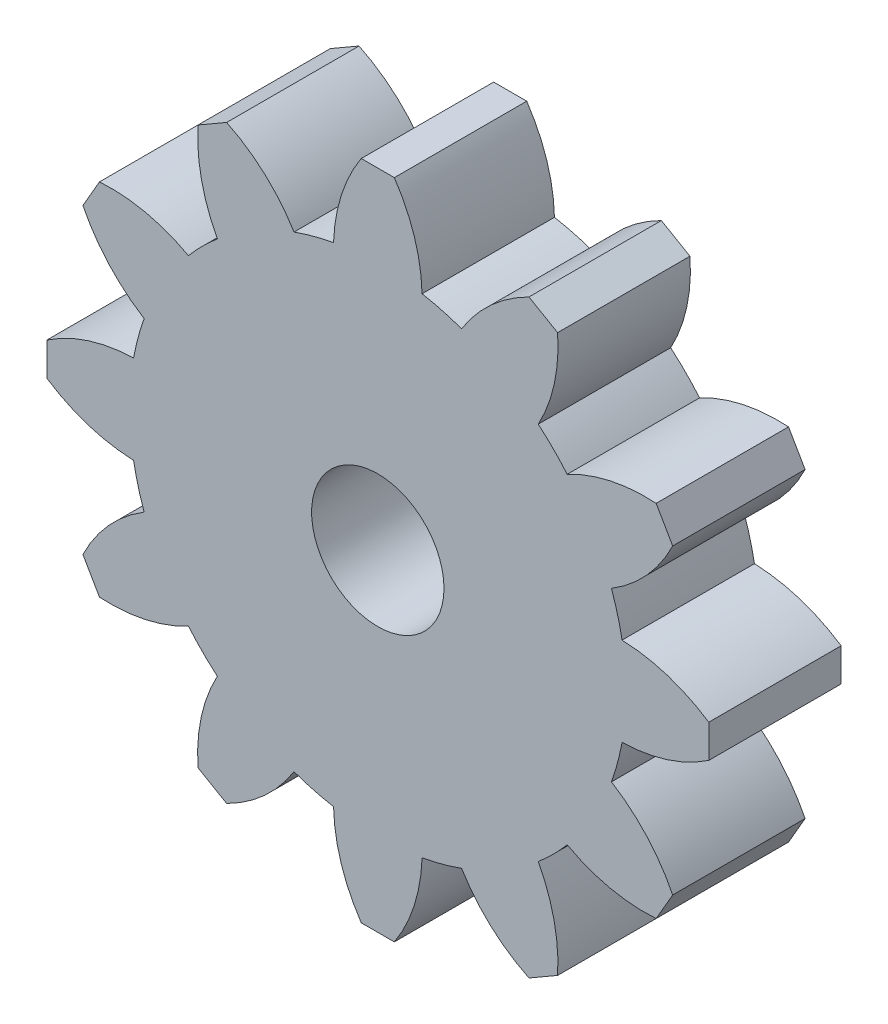
from build123d import *

# Parameters (mm, degrees)
SKETCH1_R           = 4
BOSS_EXTRUDE1_DEPTH = 8


with BuildPart() as part:
    # Sketch1 → Boss-Extrude1 (new body)
    with BuildSketch(Plane(origin=(0, 0, 0), x_dir=(0, 1, 0), z_dir=(0, 0, 1))):
        with BuildLine():
            ThreePointArc((16.820508076, 10.866025404), (14.05137554, 10.65443031), (11.444646973, 9.696393951))
            ThreePointArc((11.444646973, 9.696393951), (10.606601718, 10.606601718), (9.696393951, 11.444646973))
            ThreePointArc((9.696393951, 11.444646973), (10.668335485, 14.048350177), (10.866025404, 16.820508076))
            Line((10.866025404, 16.820508076), (9.133974596, 17.820508076))
            ThreePointArc((9.133974596, 17.820508076), (6.841633021, 16.252695081), (5.063158041, 14.119646973))
            ThreePointArc((5.063158041, 14.119646973), (3.882285677, 14.488887394), (2.675, 14.759551992))
            ThreePointArc((2.675, 14.759551992), (2.214874458, 17.500395877), (1, 20))
            Line((1, 20), (-1, 20))
            ThreePointArc((-1, 20), (-2.201319541, 17.496063331), (-2.675, 14.759551992))
            ThreePointArc((-2.675, 14.759551992), (-3.882285677, 14.488887394), (-5.063158041, 14.119646973))
            ThreePointArc((-5.063158041, 14.119646973), (-6.832060392, 16.263224635), (-9.133974596, 17.820508076))
            Line((-9.133974596, 17.820508076), (-10.866025404, 16.820508076))
            ThreePointArc((-10.866025404, 16.820508076), (-10.65443031, 14.05137554), (-9.696393951, 11.444646973))
            ThreePointArc((-9.696393951, 11.444646973), (-10.606601718, 10.606601718), (-11.444646973, 9.696393951))
            ThreePointArc((-11.444646973, 9.696393951), (-14.048350177, 10.668335485), (-16.820508076, 10.866025404))
            Line((-16.820508076, 10.866025404), (-17.820508076, 9.133974596))
            ThreePointArc((-17.820508076, 9.133974596), (-16.252695081, 6.841633021), (-14.119646973, 5.063158041))
            ThreePointArc((-14.119646973, 5.063158041), (-14.488887394, 3.882285677), (-14.759551992, 2.675))
            ThreePointArc((-14.759551992, 2.675), (-17.500395877, 2.214874458), (-20, 1))
            Line((-20, 1), (-20, -1))
            ThreePointArc((-20, -1), (-17.496063331, -2.201319541), (-14.759551992, -2.675))
            ThreePointArc((-14.759551992, -2.675), (-14.488887394, -3.882285677), (-14.119646973, -5.063158041))
            ThreePointArc((-14.119646973, -5.063158041), (-16.263224635, -6.832060392), (-17.820508076, -9.133974596))
            Line((-17.820508076, -9.133974596), (-16.820508076, -10.866025404))
            ThreePointArc((-16.820508076, -10.866025404), (-14.05137554, -10.65443031), (-11.444646973, -9.696393951))
            ThreePointArc((-11.444646973, -9.696393951), (-10.606601718, -10.606601718), (-9.696393951, -11.444646973))
            ThreePointArc((-9.696393951, -11.444646973), (-10.668335485, -14.048350177), (-10.866025404, -16.820508076))
            Line((-10.866025404, -16.820508076), (-9.133974596, -17.820508076))
            ThreePointArc((-9.133974596, -17.820508076), (-6.841633021, -16.252695081), (-5.063158041, -14.119646973))
            ThreePointArc((-5.063158041, -14.119646973), (-3.882285677, -14.488887394), (-2.675, -14.759551992))
            ThreePointArc((-2.675, -14.759551992), (-2.214874458, -17.500395877), (-1, -20))
            Line((-1, -20), (1, -20))
            ThreePointArc((1, -20), (2.201319541, -17.496063331), (2.675, -14.759551992))
            ThreePointArc((2.675, -14.759551992), (3.882285677, -14.488887394), (5.063158041, -14.119646973))
            ThreePointArc((5.063158041, -14.119646973), (6.832060392, -16.263224635), (9.133974596, -17.820508076))
            Line((9.133974596, -17.820508076), (10.866025404, -16.820508076))
            ThreePointArc((10.866025404, -16.820508076), (10.65443031, -14.05137554), (9.696393951, -11.444646973))
            ThreePointArc((9.696393951, -11.444646973), (10.606601718, -10.606601718), (11.444646973, -9.696393951))
            ThreePointArc((11.444646973, -9.696393951), (14.048350177, -10.668335485), (16.820508076, -10.866025404))
            Line((16.820508076, -10.866025404), (17.820508076, -9.133974596))
            ThreePointArc((17.820508076, -9.133974596), (16.252695081, -6.841633021), (14.119646973, -5.063158041))
            ThreePointArc((14.119646973, -5.063158041), (14.488887394, -3.882285677), (14.759551992, -2.675))
            ThreePointArc((14.759551992, -2.675), (17.500395877, -2.214874458), (20, -1))
            Line((20, -1), (20, 1))
            ThreePointArc((20, 1), (17.496063331, 2.201319541), (14.759551992, 2.675))
            ThreePointArc((14.759551992, 2.675), (14.488887394, 3.882285677), (14.119646973, 5.063158041))
            ThreePointArc((14.119646973, 5.063158041), (16.263224635, 6.832060392), (17.820508076, 9.133974596))
            Line((17.820508076, 9.133974596), (16.820508076, 10.866025404))
        make_face()
        with Locations(Location((0, 0, 0), (0, 0, 270))):
            Circle(SKETCH1_R, mode=Mode.SUBTRACT)
    extrude(amount=BOSS_EXTRUDE1_DEPTH)


solid = part.part
